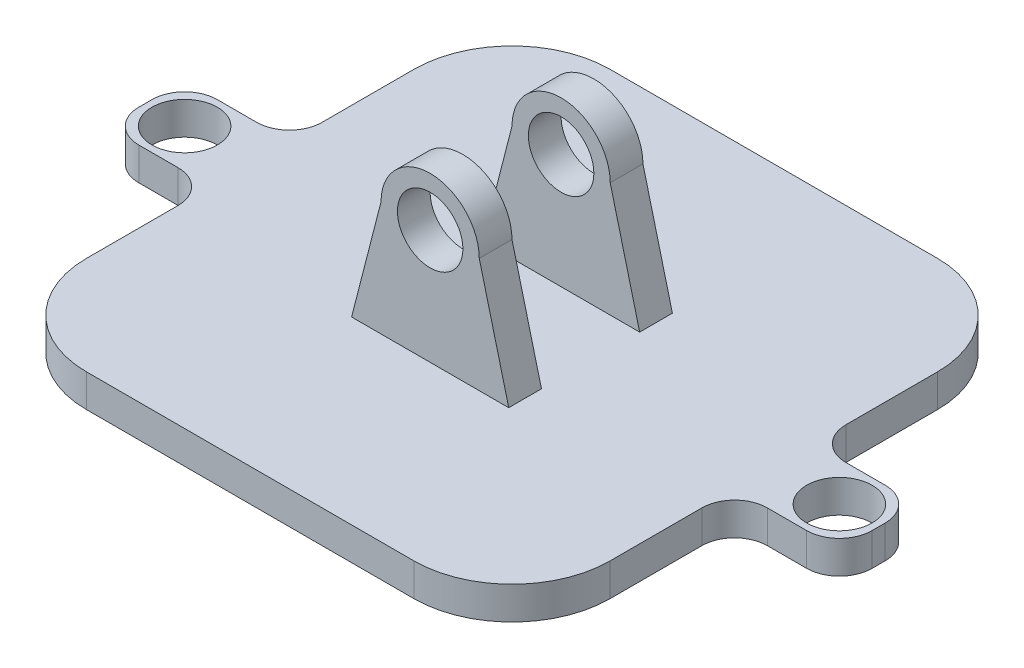
from build123d import *

# Parameters (mm, degrees)
SKETCH1_R           = 5
BOSS_EXTRUDE1_DEPTH = 2.5
FILLET1_R           = 5
BOSS_EXTRUDE2_START = 10
BOSS_EXTRUDE2_DEPTH = 2.5
BOSS_EXTRUDE3_START = -10
BOSS_EXTRUDE3_DEPTH = 2.5
SKETCH3_R           = 5
CUT_EXTRUDE1_DEPTH  = 82.538334543


with BuildPart() as part:
    # Sketch1 → Boss-Extrude1 (new, symmetric)
    with BuildSketch(Plane(origin=(0, 0, 0), x_dir=(1, 0, 0), z_dir=(0, 1, 0))):
        with BuildLine():
            Line((-40, 6), (-56, 6))
            Line((-56, 6), (-56, -6))
            Line((-56, -6), (-40, -6))
            Line((-40, -6), (-40, -25))
            ThreePointArc((-40, -25), (-35.606601718, -35.606601718), (-25, -40))
            Line((-25, -40), (25, -40))
            ThreePointArc((25, -40), (35.606601718, -35.606601718), (40, -25))
            Line((40, -25), (40, -6))
            Line((40, -6), (56, -6))
            Line((56, -6), (56, 6))
            Line((56, 6), (40, 6))
            Line((40, 6), (40, 25))
            ThreePointArc((40, 25), (35.606601718, 35.606601718), (25, 40))
            Line((25, 40), (-25, 40))
            ThreePointArc((-25, 40), (-35.606601718, 35.606601718), (-40, 25))
            Line((-40, 25), (-40, 6))
        make_face()
        with Locations((-50, 0)):
            Circle(SKETCH1_R, mode=Mode.SUBTRACT)
        with Locations((50, 0)):
            Circle(SKETCH1_R, mode=Mode.SUBTRACT)
    extrude(amount=BOSS_EXTRUDE1_DEPTH, both=True)

    # Fillet1
    fillet1_edges = [part.edges().sort_by_distance(p)[0] for p in [
        (-40, 0, 6),
        (-56, 0, 6),
        (-56, 0, -6),
        (-40, 0, -6),
        (40, 0, -6),
        (56, 0, -6),
        (56, 0, 6),
        (40, 0, 6),
    ]]
    fillet(fillet1_edges, radius=FILLET1_R)

    # Sketch2 → Boss-Extrude2 (add, symmetric)
    with BuildSketch(Plane.XY.offset(BOSS_EXTRUDE2_START)):
        with BuildLine():
            Line((-7.5, 20), (-12, 2.5))
            Line((-12, 2.5), (12, 2.5))
            Line((12, 2.5), (7.5, 20))
            ThreePointArc((7.5, 20), (0, 27.5), (-7.5, 20))
        make_face()
    extrude(amount=BOSS_EXTRUDE2_DEPTH, both=True)

    # Sketch2<6> → Boss-Extrude3 (add, symmetric)
    with BuildSketch(Plane.XY.offset(BOSS_EXTRUDE3_START)):
        with BuildLine():
            ThreePointArc((7.5, 20), (0, 27.5), (-7.5, 20))
            Line((-7.5, 20), (-12, 2.5))
            Line((-12, 2.5), (12, 2.5))
            Line((12, 2.5), (7.5, 20))
        make_face()
    extrude(amount=BOSS_EXTRUDE3_DEPTH, both=True)

    # Sketch3 → Cut-Extrude1 (cut, through all)
    with BuildSketch(Plane.XY.offset(12.5)):
        with Locations((0, 20)):
            Circle(SKETCH3_R)
    extrude(amount=-CUT_EXTRUDE1_DEPTH, mode=Mode.SUBTRACT)


solid = part.part
